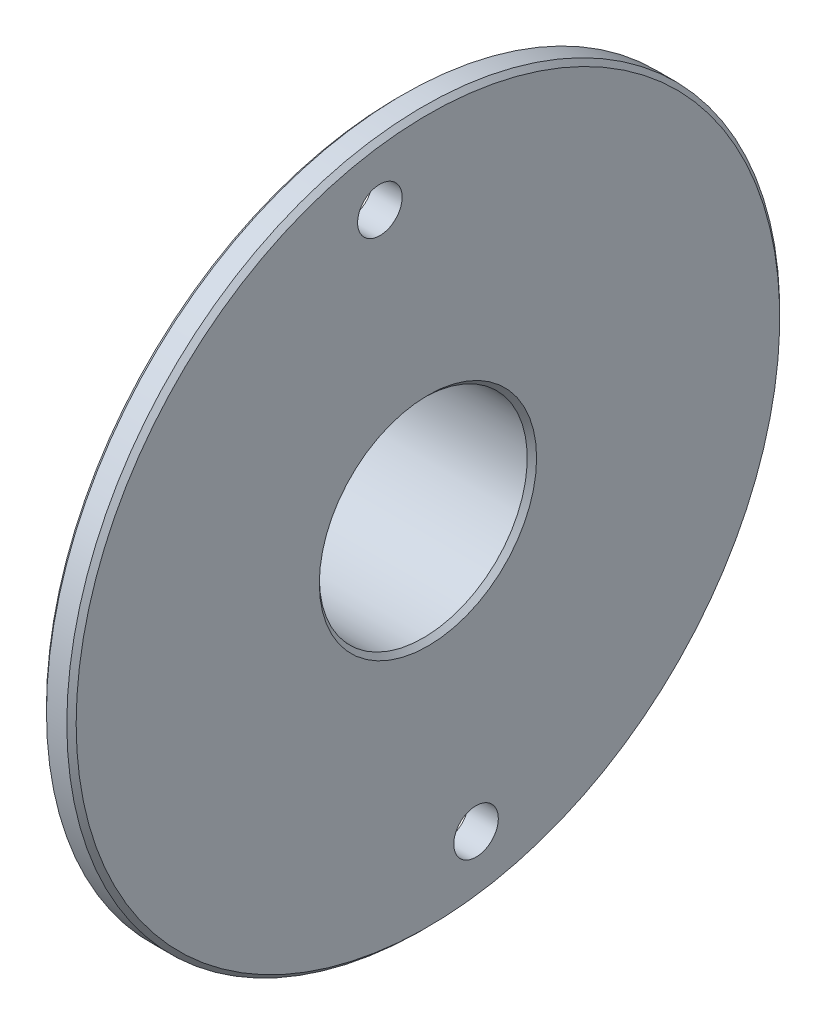
from build123d import *

# Parameters (mm, degrees)
SKETCH2_R          = 2.38125
CUT_EXTRUDE1_DEPTH = 10


with BuildPart() as part:
    # Sketch1 → Revolve1 (revolve)
    with BuildSketch(Plane.XY, mode=Mode.PRIVATE) as revolve1_sk:
        Polygon((-15.825, 13.7875), (-15.825, 11.6125), (-15.325, 11.1125), (2.675, 11.1125), (3.175, 11.6125), (3.175, 37.6), (2.675, 38.1), (0.5, 38.1), (0, 37.6), (0, 14.2875), (-15.325, 14.2875), align=None)
    revolve(revolve1_sk.sketch.rotate(Axis((0, 0, 0), (1, 0, 0)), 90), axis=Axis((0, 0, 0), (1, 0, 0)))

    # Sketch2 → Cut-Extrude1 (cut)
    with BuildSketch(Plane(origin=(3.175, 0, 0), x_dir=(0, 0, -1), z_dir=(1, 0, 0))):
        with Locations((-5.139303331, 31.331295238)):
            Circle(SKETCH2_R)
        with Locations((5.139303331, -31.331295238)):
            Circle(SKETCH2_R)
    extrude(amount=-CUT_EXTRUDE1_DEPTH, mode=Mode.SUBTRACT)


solid = part.part
